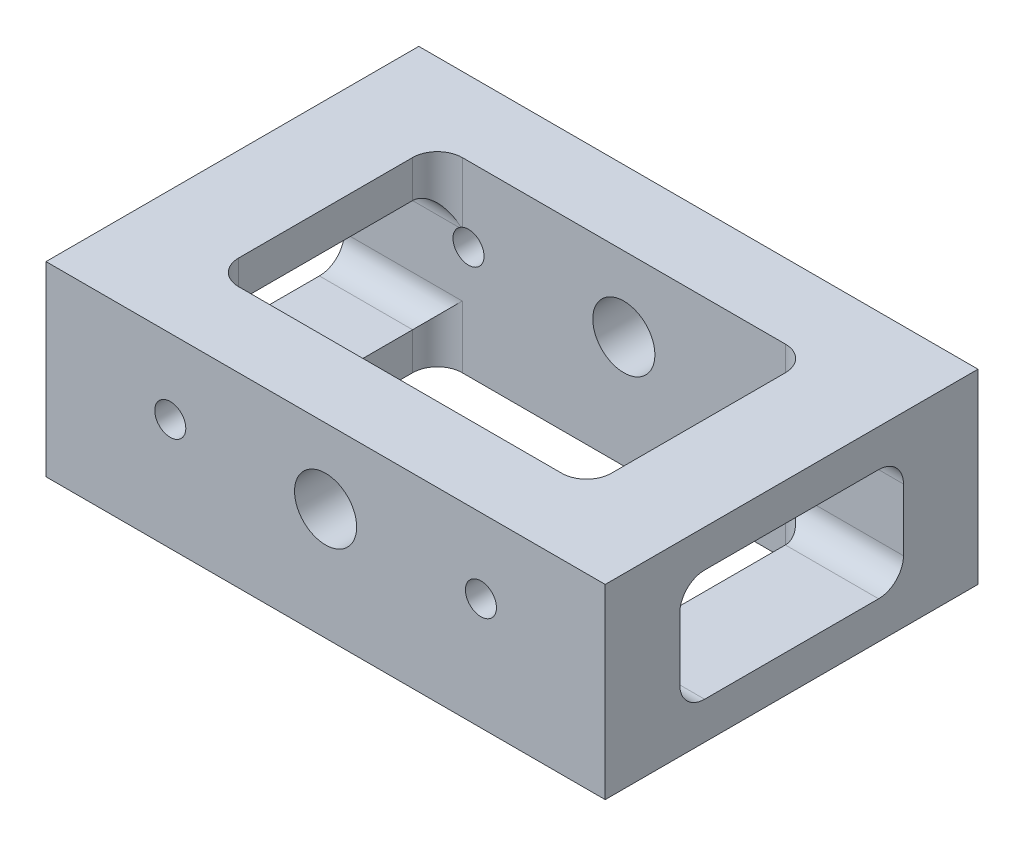
from build123d import *

# Parameters (mm, degrees)
SKETCH_1_W                  = 90
SKETCH_1_H                  = 60
EXTRUDE_1_DEPTH             = 30
HOLE_WIZARD_1_D             = 10
HOLE_WIZARD_M6_1_AT_2_COUNT = 2
HOLE_WIZARD_M6_1_AT_2_PITCH = 50
CUT_EXTRUDE_1_DEPTH         = 62.846584384
HOLE_WIZARD_M6_2_D          = 5
HOLE_WIZARD_M6_2_DEPTH      = 15
HOLE_WIZARD_M6_2_TIP        = 1.502151548
CUT_EXTRUDE_2_DEPTH         = 100.498743771


with BuildPart() as part:
    # 草图1 → 凸台-拉伸1 (new body)
    with BuildSketch(Plane(origin=(0, 0, 0), x_dir=(1, 0, 0), z_dir=(0, 1, 0))):
        Rectangle(SKETCH_1_W, SKETCH_1_H)
    extrude(amount=EXTRUDE_1_DEPTH)

    # 孔1 (through all)
    with Locations(Plane.XY.offset(30)):
        with Locations((0, 18)):
            Hole(HOLE_WIZARD_1_D / 2)

    # 草图4 → M6 螺纹孔1 (revolve, cut)
    with BuildSketch(Plane(origin=(-25, 18, 30), x_dir=(0, -1, 0), z_dir=(1, 0, 0))):
        Polygon((0, 0), (0, 16.502151548), (2.5, 15), (2.5, 0), align=None)
    hole_wizard_m6_1 = revolve(axis=Axis((-25, 18, 36.35), (0, 0, -1)), mode=Mode.SUBTRACT)

    # M6 螺纹孔1 at 2: M6 螺纹孔1 ×2
    with Locations(*[(i * HOLE_WIZARD_M6_1_AT_2_PITCH, 0, 0) for i in range(1, HOLE_WIZARD_M6_1_AT_2_COUNT)]):
        add(hole_wizard_m6_1, mode=Mode.SUBTRACT)

    # 镜向1: M6 螺纹孔1 across plane
    add(hole_wizard_m6_1.mirror(Plane.XY), mode=Mode.SUBTRACT)

    # 镜向1 copy 1 sketch → 镜向1 copy 1 (revolve, cut)
    with BuildSketch(Plane(origin=(25, 18, -30), x_dir=(0, -1, 0), z_dir=(1, 0, 0))):
        Polygon((0, 0), (0, -16.502151548), (2.5, -15), (2.5, 0), align=None)
    revolve(axis=Axis((25, 18, -36.35), (0, 0, -1)), mode=Mode.SUBTRACT)

    # 草图6 → 切除-拉伸1 (cut, through all)
    with BuildSketch(Plane(origin=(0, 30, 0), x_dir=(1, 0, 0), z_dir=(0, 1, 0))):
        with BuildLine():
            Line((-26, -18), (26, -18))
            ThreePointArc((26, -18), (28.828427125, -16.828427125), (30, -14))
            Line((30, -14), (30, 14))
            ThreePointArc((30, 14), (28.828427125, 16.828427125), (26, 18))
            Line((26, 18), (-26, 18))
            ThreePointArc((-26, 18), (-28.828427125, 16.828427125), (-30, 14))
            Line((-30, 14), (-30, -14))
            ThreePointArc((-30, -14), (-28.828427125, -16.828427125), (-26, -18))
        make_face()
    extrude(amount=-CUT_EXTRUDE_1_DEPTH, mode=Mode.SUBTRACT)

    # M6 螺纹孔2
    with Locations(Plane(origin=(0, 0, 0), x_dir=(-1, 0, 0), z_dir=(0, -1, 0))):
        with Locations((-39, -24), (39, -24), (39, 24), (-39, 24)):
            Hole(HOLE_WIZARD_M6_2_D / 2, depth=HOLE_WIZARD_M6_2_DEPTH)
            with Locations((0, 0, -(HOLE_WIZARD_M6_2_DEPTH + HOLE_WIZARD_M6_2_TIP / 2))):  # 118° drill point
                Cone(0, HOLE_WIZARD_M6_2_D / 2, HOLE_WIZARD_M6_2_TIP, mode=Mode.SUBTRACT)

    # 草图9 → 切除-拉伸2 (cut, through all)
    with BuildSketch(Plane(origin=(45, 0, 0), x_dir=(0, 0, -1), z_dir=(1, 0, 0))):
        with BuildLine():
            Line((-14, 6), (14, 6))
            ThreePointArc((14, 6), (16.828427125, 7.171572875), (18, 10))
            Line((18, 10), (18, 20))
            ThreePointArc((18, 20), (16.828427125, 22.828427125), (14, 24))
            Line((14, 24), (-14, 24))
            ThreePointArc((-14, 24), (-16.828427125, 22.828427125), (-18, 20))
            Line((-18, 20), (-18, 10))
            ThreePointArc((-18, 10), (-16.828427125, 7.171572875), (-14, 6))
        make_face()
    extrude(amount=-CUT_EXTRUDE_2_DEPTH, mode=Mode.SUBTRACT)


solid = part.part
